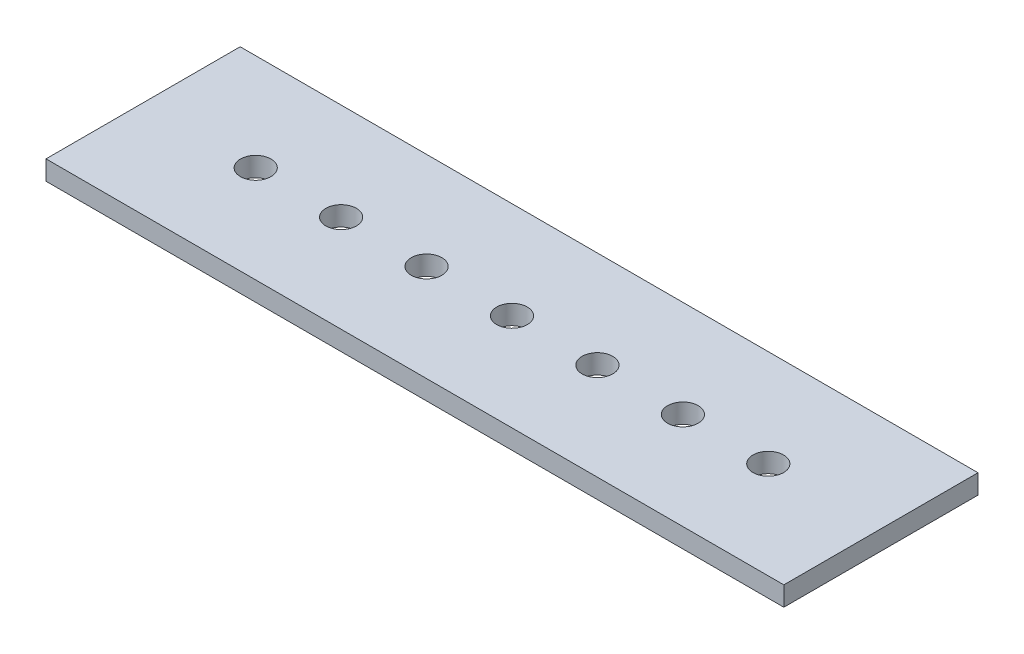
from build123d import *

# Parameters (mm, degrees)
SKETCH1_W           = 120.65
SKETCH1_H           = 31.75
BOSS_EXTRUDE1_DEPTH = 3.175
SKETCH2_R           = 2.5
CUT_EXTRUDE1_DEPTH  = 5.08
LPATTERN2_COUNT     = 4
LPATTERN2_PITCH     = 13.97
LPATTERN2_COL_COUNT = 4
LPATTERN2_COL_PITCH = 13.97


with BuildPart() as part:
    # Sketch1 → Boss-Extrude1 (new body)
    with BuildSketch(Plane(origin=(0, 0, 0), x_dir=(1, 0, 0), z_dir=(0, 1, 0))):
        with Locations((60.325, 15.875)):
            Rectangle(SKETCH1_W, SKETCH1_H)
    extrude(amount=BOSS_EXTRUDE1_DEPTH)

    # Sketch2 → Cut-Extrude1 (cut)
    with BuildSketch(Plane(origin=(0, 3.175, 0), x_dir=(1, 0, 0), z_dir=(0, 1, 0))):
        with Locations(Location((60.325, 15.875, 0), (0, 0, 270))):
            Circle(SKETCH2_R)
    cut_extrude1 = extrude(amount=-CUT_EXTRUDE1_DEPTH, mode=Mode.SUBTRACT)

    # LPattern2: Cut-Extrude1 ×4
    with Locations(*[(i * LPATTERN2_PITCH, 0, 0) for i in range(1, LPATTERN2_COUNT)]):
        add(cut_extrude1, mode=Mode.SUBTRACT)

    # LPattern2 col: Cut-Extrude1 ×4
    with Locations(*[(-i * LPATTERN2_COL_PITCH, 0, 0) for i in range(1, LPATTERN2_COL_COUNT)]):
        add(cut_extrude1, mode=Mode.SUBTRACT)


solid = part.part
